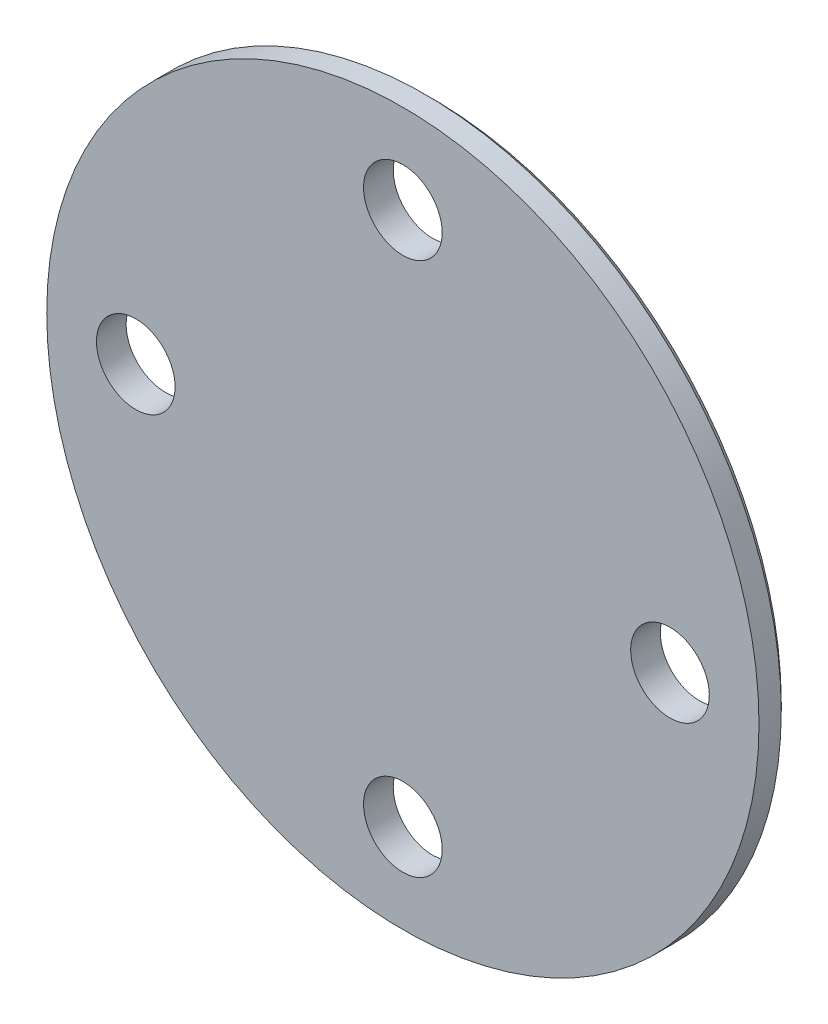
from build123d import *

# Parameters (mm, degrees)
SKETCH1_R            = 24
EXTRUDE1_DEPTH       = 2
M5_CLEARANCE_HOLE1_D = 5.3
CIRPATTERN1_COUNT    = 4
CHAMFER1_SIZE        = 0.5
EXTRUDE3_DEPTH       = 0.6


with BuildPart() as part:
    # Sketch1 → Extrude1 (new body)
    with BuildSketch(Plane.XY):
        Circle(SKETCH1_R)
    extrude(amount=EXTRUDE1_DEPTH)

    # M5 Clearance Hole1 (through all)
    with Locations(Plane.XY.offset(2)):
        with Locations((0, 18)):
            m5_clearance_hole1 = Hole(M5_CLEARANCE_HOLE1_D / 2)

    # CirPattern1: M5 Clearance Hole1 ×4 about axis
    cirpattern1_axis = Axis((0, 0, 0), (0, 0, 1))
    for i in range(1, CIRPATTERN1_COUNT):
        add(m5_clearance_hole1.rotate(cirpattern1_axis, i * 360 / CIRPATTERN1_COUNT), mode=Mode.SUBTRACT)

    # Chamfer1
    chamfer1_edges = [part.edges().sort_by_distance(p)[0] for p in [
        (-24, 0, 0),
    ]]
    chamfer(chamfer1_edges, length=CHAMFER1_SIZE)

    # Sketch5 → Extrude3 (add)
    # profile 1 of 8: a face of its own
    with BuildSketch(Plane(origin=(0, 0, 0), x_dir=(-1, 0, 0), z_dir=(0, 0, -1))):
        with BuildLine():
            add(Edge.make_bspline(
                [(12.477495957, 2.884516023), (12.536071241, 2.891620093), (12.649830325, 2.905416909), (12.815945841, 2.918469115), (12.972334316, 2.926140843), (13.119140248, 2.928060901), (13.256568937, 2.922845549), (13.384387248, 2.911965877), (13.50264742, 2.895216624), (13.611865093, 2.871971693), (13.713460629, 2.843682261), (13.808972596, 2.810349152), (13.89851728, 2.771287362), (13.983929117, 2.72977982), (14.062243389, 2.680769956), (14.136424629, 2.628997822), (14.204920737, 2.571867494), (14.267022146, 2.509156183), (14.323992727, 2.443604504), (14.375074252, 2.3747651), (14.419318927, 2.302802961), (14.45821084, 2.228254683), (14.491140967, 2.150969492), (14.51687187, 2.070387153), (14.537303208, 1.987094789), (14.545712521, 1.930114835), (14.549959398, 1.901338773)],
                knots=[0, 0, 0, 0, 1.646160064, 3.19700812, 4.647898815, 6.01440281, 7.292035329, 8.483544157, 9.592253132, 10.622287969, 11.596797606, 12.533148565, 13.442037284, 14.321633635, 15.179742425, 16.016494889, 16.844435573, 17.664254319, 18.476427132, 19.265941802, 20.053070085, 20.830916409, 21.61023083, 22.393720316, 23.188795335, 24, 24, 24, 24], degree=3))
            add(Edge.make_bspline(
                [(14.549959398, 1.901338773), (14.553241451, 1.871938902), (14.559736814, 1.813754934), (14.559588067, 1.726640245), (14.555188321, 1.640971456), (14.541849257, 1.556756053), (14.523606348, 1.473565488), (14.498453399, 1.391488907), (14.465114438, 1.311310245), (14.426875191, 1.231910054), (14.38192801, 1.154472679), (14.328329249, 1.081180977), (14.269925873, 1.009306125), (14.203429001, 0.941052023), (14.130068239, 0.875773566), (14.049226062, 0.81426467), (13.962452107, 0.754819633), (13.868572007, 0.698100592), (13.766449132, 0.645011869), (13.654810709, 0.597279176), (13.534219292, 0.552666707), (13.404249292, 0.511897383), (13.264550774, 0.475639241), (13.11537684, 0.444264071), (12.957099441, 0.415571869), (12.848080158, 0.401022319), (12.792112677, 0.393552982)],
                knots=[0, 0, 0, 0, 0.8189708, 1.620788478, 2.4103297, 3.193420704, 3.979833012, 4.76883873, 5.568016431, 6.383280226, 7.209529894, 8.044402319, 8.89639626, 9.773593236, 10.681310487, 11.614738811, 12.586038082, 13.594415037, 14.651849842, 15.772145776, 16.956011423, 18.213101613, 19.544486485, 20.953085108, 22.43579826, 24, 24, 24, 24], degree=3))
            add(Edge.make_bspline(
                [(12.792112677, 0.393552982), (12.736250908, 0.387007225), (12.62715872, 0.374224045), (12.467289953, 0.361613871), (12.315543463, 0.355271988), (12.171974094, 0.356438485), (12.036479889, 0.361611814), (11.908872935, 0.374239694), (11.789658367, 0.393271949), (11.678243775, 0.418777778), (11.573687208, 0.449300014), (11.475308633, 0.484749339), (11.382476073, 0.524911506), (11.295672861, 0.57042193), (11.213938231, 0.619640417), (11.138646165, 0.674465823), (11.068383116, 0.73287895), (11.004813284, 0.7968969), (10.946904948, 0.864454975), (10.894922541, 0.934801304), (10.849174306, 1.008194047), (10.80996305, 1.084381352), (10.777119365, 1.163612068), (10.750639958, 1.245286242), (10.72906714, 1.329697292), (10.720845851, 1.38751191), (10.716681153, 1.416799343)],
                knots=[0, 0, 0, 0, 1.559160194, 3.044876667, 4.444802804, 5.768243258, 7.024293308, 8.202639738, 9.320937855, 10.36891014, 11.369226295, 12.338798708, 13.266208898, 14.170984024, 15.054168385, 15.908697757, 16.750671861, 17.584650095, 18.406502976, 19.215671292, 20.007214954, 20.801516048, 21.588502268, 22.382151931, 23.180438801, 24, 24, 24, 24], degree=3))
            add(Edge.make_bspline(
                [(10.716681153, 1.416799343), (10.713798401, 1.445711529), (10.708092042, 1.502942722), (10.706761965, 1.58851482), (10.711455105, 1.672742863), (10.725056397, 1.755331594), (10.741871402, 1.837093235), (10.767858423, 1.917035149), (10.799799269, 1.995543195), (10.837515397, 2.072924332), (10.882081233, 2.147942289), (10.933542689, 2.220077779), (10.991611796, 2.289530168), (11.056909914, 2.354958334), (11.128177613, 2.418039086), (11.205849537, 2.478033831), (11.290928447, 2.534318644), (11.382866855, 2.588213788), (11.48335077, 2.639175317), (11.594628519, 2.684591311), (11.71561774, 2.727702367), (11.84729415, 2.767169113), (11.989951558, 2.801315272), (12.142806188, 2.833365283), (12.30639764, 2.861631058), (12.419315122, 2.876734145), (12.477495957, 2.884516023)],
                knots=[0, 0, 0, 0, 0.811227593, 1.605811631, 2.38795517, 3.163726762, 3.941525875, 4.71714365, 5.507391262, 6.30760138, 7.119181885, 7.941540513, 8.78007692, 9.644729273, 10.520787262, 11.43692308, 12.383447017, 13.368055022, 14.412318111, 15.52722477, 16.722454676, 17.998879864, 19.36445219, 20.818252151, 22.360601563, 24, 24, 24, 24], degree=3))
        make_face()
        with BuildLine():
            add(Edge.make_bspline(
                [(12.513854964, 2.538734439), (12.463855133, 2.532070694), (12.367139077, 2.519180826), (12.227319138, 2.496199253), (12.09754414, 2.470657325), (11.977058314, 2.445035169), (11.867266986, 2.413888899), (11.766745793, 2.382507433), (11.676057106, 2.348381764), (11.594235639, 2.312205785), (11.520861297, 2.271712579), (11.452335117, 2.230868), (11.389955575, 2.185951626), (11.332399495, 2.138951901), (11.279439122, 2.089667366), (11.232927956, 2.036304097), (11.189925025, 1.981757604), (11.142845632, 1.905281925), (11.094359054, 1.808328626), (11.056400076, 1.688257092), (11.039725407, 1.566781211), (11.045486195, 1.486559687), (11.048364346, 1.446480166)],
                knots=[0, 0, 0, 0, 1.481549245, 2.865801675, 4.1609391, 5.366569088, 6.482275719, 7.511592454, 8.458824832, 9.32703844, 10.136451955, 10.918910015, 11.668854611, 12.391634065, 13.100850064, 13.790445644, 14.469047107, 15.138250289, 16.424883389, 17.642709367, 18.822272667, 20, 20, 20, 20], degree=3))
            add(Edge.make_bspline(
                [(11.048364346, 1.446480166), (11.055352189, 1.406532039), (11.06924168, 1.327128547), (11.115727462, 1.213751989), (11.181217413, 1.107805123), (11.250196921, 1.026004325), (11.314097883, 0.965371681), (11.368306397, 0.923949679), (11.426009553, 0.884801628), (11.489487941, 0.851055459), (11.557161895, 0.820586048), (11.629207161, 0.793735228), (11.706246552, 0.77161198), (11.759402862, 0.759597175), (11.786674809, 0.753432957)],
                knots=[0, 0, 0, 0, 1.343251979, 2.669934932, 4.037491568, 5.465357782, 6.208982507, 6.958028626, 7.727853465, 8.521530074, 9.341164449, 10.19081478, 11.071794052, 12, 12, 12, 12], degree=3))
            add(Edge.make_bspline(
                [(11.786674809, 0.753432957), (11.821244316, 0.746665168), (11.891589835, 0.732893388), (12.000073832, 0.718260277), (12.112996247, 0.708597848), (12.230362794, 0.704531881), (12.351905273, 0.704243879), (12.477853154, 0.709971733), (12.608337704, 0.719149127), (12.696674292, 0.729574065), (12.741655278, 0.734882443)],
                knots=[0, 0, 0, 0, 0.880914058, 1.792572832, 2.736348082, 3.714513723, 4.729093608, 5.775502275, 6.867285877, 8, 8, 8, 8], degree=3))
            add(Edge.make_bspline(
                [(12.741655278, 0.734882443), (12.786449829, 0.741125914), (12.873973782, 0.753325015), (13.001850971, 0.774355493), (13.122657028, 0.800111077), (13.237079372, 0.826788402), (13.344363208, 0.85838733), (13.444856533, 0.892308398), (13.539254641, 0.928517217), (13.626435128, 0.968729848), (13.707927946, 1.010899061), (13.78247734, 1.056206711), (13.851241724, 1.102767603), (13.913117529, 1.152034536), (13.968980057, 1.203297605), (14.018970278, 1.256595356), (14.062268866, 1.312626187), (14.110759345, 1.388723528), (14.158963081, 1.485800162), (14.195644461, 1.605560939), (14.214036195, 1.725821945), (14.207454717, 1.805348908), (14.204177814, 1.84494521)],
                knots=[0, 0, 0, 0, 1.328855588, 2.596447408, 3.806487924, 4.957476961, 6.047549486, 7.090885507, 8.073349382, 9.016400378, 9.910289389, 10.767751521, 11.578063205, 12.348689573, 13.089297393, 13.804031864, 14.493032821, 15.166333401, 16.453357801, 17.662459598, 18.836143723, 20, 20, 20, 20], degree=3))
            add(Edge.make_bspline(
                [(14.204177814, 1.84494521), (14.197231442, 1.884911641), (14.183369139, 1.964669353), (14.136034884, 2.078043906), (14.070472276, 2.185080374), (13.99997182, 2.266904792), (13.934278077, 2.327160883), (13.881024653, 2.370950388), (13.822023077, 2.408934853), (13.759322563, 2.444414282), (13.69184736, 2.475087268), (13.620103617, 2.502948706), (13.543867229, 2.526227803), (13.462786282, 2.546846555), (13.37476, 2.562338569), (13.27838954, 2.573414142), (13.172840059, 2.578891885), (13.058487666, 2.580222795), (12.935211448, 2.57733631), (12.802861723, 2.568672943), (12.661321335, 2.55622029), (12.564037474, 2.544684839), (12.513854964, 2.538734439)],
                knots=[0, 0, 0, 0, 1.188402085, 2.371596053, 3.581500958, 4.864415805, 5.527629525, 6.199344559, 6.886481004, 7.585800319, 8.313961935, 9.061439639, 9.845047304, 10.653847106, 11.517469494, 12.468223364, 13.501530155, 14.620478798, 15.826866625, 17.122554849, 18.515710453, 20, 20, 20, 20], degree=3))
        make_face(mode=Mode.SUBTRACT)
    # profile 2 of 8: a face of its own
    with BuildSketch(Plane(origin=(0, 0, 0), x_dir=(-1, 0, 0), z_dir=(0, 0, -1))):
        with BuildLine():
            Line((12.435971824, 5.884157529), (12.293503876, 6.232165174))
            add(Edge.make_bspline(
                [(12.293503876, 6.232165174), (12.331280671, 6.237902871), (12.40534285, 6.249151742), (12.515263329, 6.256469201), (12.621116087, 6.255573137), (12.723268789, 6.248188383), (12.821273107, 6.23022784), (12.916080704, 6.207448974), (13.006173395, 6.17405292), (13.092228333, 6.134008513), (13.173999076, 6.087580944), (13.249553014, 6.033812022), (13.319845204, 5.975072136), (13.384186649, 5.910174885), (13.441771972, 5.838706138), (13.494298416, 5.761768841), (13.540290213, 5.678682518), (13.565798197, 5.619973906), (13.578683496, 5.590317385)],
                knots=[0, 0, 0, 0, 1.172435098, 2.298583014, 3.376645, 4.420068463, 5.437284351, 6.431577994, 7.40903483, 8.380428988, 9.34279227, 10.290642714, 11.222827663, 12.151543775, 13.090597273, 14.036042813, 15.007911516, 16, 16, 16, 16], degree=3))
            add(Edge.make_bspline(
                [(13.578683496, 5.590317385), (13.595146256, 5.545898301), (13.627709113, 5.458038655), (13.656515698, 5.320973388), (13.667456635, 5.182377318), (13.662293481, 5.043912607), (13.641456008, 4.908623912), (13.603087654, 4.780507218), (13.549706476, 4.660497306), (13.479620575, 4.551401837), (13.398553748, 4.453394), (13.307273874, 4.369837509), (13.207798414, 4.299446115), (13.134582671, 4.266176063), (13.097854169, 4.249486221)],
                knots=[0, 0, 0, 0, 1.078578962, 2.133397599, 3.17974609, 4.24031875, 5.284843273, 6.290806044, 7.279915296, 8.268317422, 9.236972897, 10.170611521, 11.082291665, 12, 12, 12, 12], degree=3))
            add(Edge.make_bspline(
                [(13.097854169, 4.249486221), (13.061572721, 4.236020236), (12.990080433, 4.209485625), (12.878581355, 4.189144238), (12.767663499, 4.184468358), (12.657055763, 4.196056075), (12.546201078, 4.222761179), (12.436190489, 4.267630181), (12.32607983, 4.327293502), (12.256620191, 4.377290799), (12.22078586, 4.403084479)],
                knots=[0, 0, 0, 0, 0.991021073, 1.952798622, 2.89245852, 3.829845753, 4.796111031, 5.80685455, 6.868552999, 8, 8, 8, 8], degree=3))
            add(Edge.make_bspline(
                [(12.22078586, 4.403084479), (12.219526842, 4.356226476), (12.217045109, 4.263861612), (12.192368439, 4.128777728), (12.152960151, 3.999731155), (12.113555882, 3.919820709), (12.093900343, 3.87995998)],
                knots=[0, 0, 0, 0, 1.033136608, 2.036482921, 3.020563313, 4, 4, 4, 4], degree=3))
            add(Edge.make_bspline(
                [(12.093900343, 3.87995998), (12.078543603, 3.852949145), (12.048184514, 3.799550812), (11.994922641, 3.725524214), (11.938033664, 3.656675869), (11.875147834, 3.594834717), (11.807500184, 3.539105682), (11.73519472, 3.489377457), (11.658658791, 3.444765587), (11.604188994, 3.42133724), (11.576712009, 3.409518941)],
                knots=[0, 0, 0, 0, 1.044431912, 2.064761268, 3.062869618, 4.045321493, 5.026398593, 6.00719345, 6.994739879, 8, 8, 8, 8], degree=3))
            add(Edge.make_bspline(
                [(11.576712009, 3.409518941), (11.528146448, 3.391802168), (11.431023132, 3.35637147), (11.277609313, 3.328211629), (11.120013893, 3.320003104), (10.98699961, 3.330481543), (10.880986956, 3.349406421), (10.802639283, 3.367501262), (10.727203126, 3.392266067), (10.654000478, 3.421570531), (10.582373472, 3.454573341), (10.513750916, 3.494115708), (10.447121963, 3.538290032), (10.361404648, 3.603254243), (10.261796112, 3.695722452), (10.158484216, 3.823532381), (10.067936362, 3.965041649), (10.021865975, 4.068498043), (9.998434264, 4.121116664)],
                knots=[0, 0, 0, 0, 1.284270031, 2.568333665, 3.862311068, 5.201681707, 5.876450447, 6.540614514, 7.200288132, 7.849314621, 8.501716024, 9.160384414, 9.817441239, 10.489398431, 11.834734864, 13.185968722, 14.56876468, 16, 16, 16, 16], degree=3))
            add(Edge.make_bspline(
                [(9.998434264, 4.121116664), (9.98448603, 4.157270881), (9.957031064, 4.228434934), (9.926676026, 4.336934238), (9.906447723, 4.444219818), (9.89621011, 4.550004096), (9.894194243, 4.654307221), (9.90317057, 4.757524618), (9.922990128, 4.859175558), (9.95073027, 4.959847774), (9.989766503, 5.057830508), (10.037929073, 5.153275096), (10.096981035, 5.244934877), (10.166617348, 5.332609705), (10.24561618, 5.417350973), (10.334175111, 5.499221468), (10.433008428, 5.577256509), (10.504387776, 5.624700604), (10.540851298, 5.648937009)],
                knots=[0, 0, 0, 0, 1.04330458, 2.05358561, 3.029635579, 3.980230507, 4.91300992, 5.835839402, 6.764828419, 7.699152938, 8.644316385, 9.600706471, 10.574594139, 11.57551847, 12.612572148, 13.692170556, 14.821065307, 16, 16, 16, 16], degree=3))
            Line((10.540851298, 5.648937009), (10.677383082, 5.315027755))
            add(Edge.make_bspline(
                [(10.677383082, 5.315027755), (10.65373795, 5.2964148), (10.60791502, 5.260343947), (10.543494503, 5.204681703), (10.486719001, 5.148231168), (10.435505448, 5.092556909), (10.391737469, 5.036105885), (10.354448268, 4.979602235), (10.323405926, 4.923168274), (10.307974482, 4.88433319), (10.300436635, 4.865363291)],
                knots=[0, 0, 0, 0, 1.214774763, 2.354164756, 3.434443773, 4.445303695, 5.405998326, 6.314363494, 7.176611707, 8, 8, 8, 8], degree=3))
            add(Edge.make_bspline(
                [(10.300436635, 4.865363291), (10.292846913, 4.841242462), (10.277756643, 4.793284203), (10.262546746, 4.719287285), (10.256472194, 4.644135648), (10.255900707, 4.567594429), (10.264708044, 4.489923096), (10.279518098, 4.410730966), (10.301642467, 4.33044664), (10.321990395, 4.277771584), (10.332343519, 4.250970263)],
                knots=[0, 0, 0, 0, 0.963882292, 1.916439689, 2.87277145, 3.834760107, 4.830461923, 5.847814843, 6.904957855, 8, 8, 8, 8], degree=3))
            add(Edge.make_bspline(
                [(10.332343519, 4.250970263), (10.345115368, 4.221005513), (10.37014265, 4.16228761), (10.416798439, 4.08083714), (10.467109039, 4.005974141), (10.522949744, 3.938713856), (10.584335386, 3.879369864), (10.64958232, 3.825708989), (10.721347258, 3.781499424), (10.797005636, 3.744515455), (10.8747113, 3.714936469), (10.953168641, 3.694249672), (11.030859219, 3.680743269), (11.108161455, 3.674251709), (11.185012228, 3.677740719), (11.261332792, 3.688055572), (11.337338473, 3.706383801), (11.386437075, 3.725079157), (11.411241422, 3.734523949)],
                knots=[0, 0, 0, 0, 1.169383745, 2.291484635, 3.366132928, 4.407225722, 5.425269315, 6.430078578, 7.436105293, 8.445579998, 9.452391384, 10.418086033, 11.356027765, 12.282959416, 13.198964182, 14.113890661, 15.047147825, 16, 16, 16, 16], degree=3))
            add(Edge.make_bspline(
                [(11.411241422, 3.734523949), (11.443744014, 3.749038521), (11.508278194, 3.777857332), (11.594597459, 3.840091415), (11.673903325, 3.9120459), (11.741040583, 3.997796619), (11.79881302, 4.090987607), (11.840078581, 4.192297391), (11.868064479, 4.297976473), (11.878838889, 4.390439368), (11.878633668, 4.468710098), (11.873887565, 4.533615352), (11.865114718, 4.604029229), (11.850506023, 4.679923591), (11.83186496, 4.761569079), (11.809016255, 4.849050153), (11.780582467, 4.941716883), (11.75916471, 5.004917241), (11.74811876, 5.037512063)],
                knots=[0, 0, 0, 0, 1.128189001, 2.240029169, 3.363390732, 4.520735173, 5.687883177, 6.836443092, 7.982014941, 9.152729103, 9.781413746, 10.466732276, 11.219227681, 12.034588583, 12.921074337, 13.879850625, 14.906558528, 16, 16, 16, 16], degree=3))
            Line((11.74811876, 5.037512063), (12.060509418, 5.1651396))
            add(Edge.make_bspline(
                [(12.060509418, 5.1651396), (12.077015845, 5.127140038), (12.109305848, 5.052804992), (12.170773682, 4.949717131), (12.238401898, 4.855032377), (12.314525542, 4.771777986), (12.394575068, 4.701099063), (12.475533279, 4.643723036), (12.55731121, 4.601699877), (12.639793723, 4.576197507), (12.721540175, 4.565225043), (12.80150871, 4.565821843), (12.880278235, 4.578236403), (12.930134102, 4.595944751), (12.955386221, 4.604914073)],
                knots=[0, 0, 0, 0, 1.268556637, 2.481560593, 3.670351794, 4.829405352, 5.930463306, 6.937762035, 7.863270479, 8.73605307, 9.570118579, 10.38127119, 11.180109913, 12, 12, 12, 12], degree=3))
            add(Edge.make_bspline(
                [(12.955386221, 4.604914073), (12.973363879, 4.612981771), (13.008959735, 4.628955854), (13.058980843, 4.658717162), (13.104348673, 4.693820261), (13.145652427, 4.73362466), (13.182764799, 4.778142839), (13.215385659, 4.827638476), (13.244698618, 4.881291146), (13.268784286, 4.939568175), (13.287903387, 5.000647163), (13.301620776, 5.063187092), (13.308006878, 5.126634592), (13.309027504, 5.190997031), (13.30277369, 5.256063048), (13.29085097, 5.322147984), (13.27224378, 5.388895425), (13.255514215, 5.432883492), (13.247000303, 5.455269642)],
                knots=[0, 0, 0, 0, 0.944852007, 1.87081184, 2.784602064, 3.690965493, 4.617761338, 5.559029823, 6.530699281, 7.546646506, 8.5787509, 9.598157268, 10.612439914, 11.633019719, 12.681569522, 13.742933038, 14.851346722, 16, 16, 16, 16], degree=3))
            add(Edge.make_bspline(
                [(13.247000303, 5.455269642), (13.231043664, 5.490255157), (13.199822918, 5.558707785), (13.135070188, 5.649284809), (13.057892421, 5.725895757), (12.983352612, 5.77767893), (12.916965999, 5.810926523), (12.86268875, 5.833687652), (12.80307935, 5.850952595), (12.738902359, 5.865245462), (12.669903249, 5.875101512), (12.596181463, 5.882969442), (12.517605773, 5.885602269), (12.463671914, 5.884647759), (12.435971824, 5.884157529)],
                knots=[0, 0, 0, 0, 1.399765487, 2.738779866, 4.033557875, 5.349651047, 6.027356497, 6.739255149, 7.492631947, 8.287062432, 9.13537895, 10.032908044, 10.989713993, 12, 12, 12, 12], degree=3))
        make_face()
    # profile 3 of 8: a face of its own
    with BuildSketch(Plane(origin=(0, 0, 0), x_dir=(-1, 0, 0), z_dir=(0, 0, -1))):
        with BuildLine():
            Line((12.012938732, 8.455749342), (12.035199349, 8.092901285))
            Line((12.035199349, 8.092901285), (10.224669167, 7.991986488))
            add(Edge.make_bspline(
                [(10.224669167, 7.991986488), (10.252749137, 7.971935096), (10.307528427, 7.932818206), (10.381481514, 7.867500238), (10.448427309, 7.801552474), (10.486078897, 7.753465899), (10.504410921, 7.730053228)],
                knots=[0, 0, 0, 0, 1.075160859, 2.097457753, 3.073679168, 4, 4, 4, 4], degree=3))
            add(Edge.make_bspline(
                [(10.504410921, 7.730053228), (10.52497768, 7.700469315), (10.565519698, 7.642152321), (10.616431258, 7.549737914), (10.655752967, 7.454282747), (10.68497864, 7.356588327), (10.703573482, 7.256358927), (10.712001506, 7.15338656), (10.708280452, 7.047802314), (10.696230284, 6.940895021), (10.672950949, 6.835460713), (10.641498852, 6.733300987), (10.599246348, 6.636442181), (10.549076429, 6.543616876), (10.487563007, 6.456892298), (10.417528517, 6.374691869), (10.337708894, 6.297957607), (10.278997874, 6.251710427), (10.249155846, 6.228203602)],
                knots=[0, 0, 0, 0, 1.018448499, 2.00760647, 2.976602704, 3.932612498, 4.886034564, 5.854323722, 6.847922934, 7.869057877, 8.892489875, 9.896814069, 10.886861882, 11.876019854, 12.875338693, 13.887378307, 14.926182571, 16, 16, 16, 16], degree=3))
            add(Edge.make_bspline(
                [(10.249155846, 6.228203602), (10.206329561, 6.198598288), (10.122234223, 6.140464159), (9.985456027, 6.074190337), (9.844081995, 6.026779277), (9.698527893, 5.999414558), (9.551190657, 5.991595972), (9.404153423, 6.005498129), (9.258268413, 6.039027318), (9.115992246, 6.093600225), (8.979923677, 6.16464502), (8.855383768, 6.253432352), (8.741131666, 6.355840384), (8.67768869, 6.436198767), (8.645649403, 6.476780492)],
                knots=[0, 0, 0, 0, 1.034471835, 2.031328584, 3.011592854, 3.993029578, 4.968515484, 5.936977143, 6.92167702, 7.936979045, 8.96043929, 9.966578995, 10.973103631, 12, 12, 12, 12], degree=3))
            add(Edge.make_bspline(
                [(8.645649403, 6.476780492), (8.61728218, 6.517886707), (8.561104698, 6.59929206), (8.497690977, 6.732844276), (8.450620514, 6.872198785), (8.4237728, 7.017060353), (8.414921035, 7.16429176), (8.428045134, 7.3103332), (8.460171735, 7.454249577), (8.512991815, 7.593534524), (8.583276231, 7.725623413), (8.668434551, 7.847904028), (8.768780457, 7.95812348), (8.846349181, 8.020172724), (8.885322045, 8.051348133)],
                knots=[0, 0, 0, 0, 1.012341825, 2.004807351, 2.989112693, 3.990490204, 4.986061848, 5.973754194, 6.956650182, 7.970248532, 8.987619532, 9.986224535, 10.988218515, 12, 12, 12, 12], degree=3))
            add(Edge.make_bspline(
                [(8.885322045, 8.051348133), (8.916833145, 8.073245486), (8.980899894, 8.117766059), (9.086249862, 8.173906403), (9.200751394, 8.22190114), (9.302581492, 8.256730947), (9.390350131, 8.279823328), (9.462082621, 8.29632945), (9.539093544, 8.310934942), (9.621198143, 8.324343002), (9.708551156, 8.335592041), (9.801187365, 8.343844962), (9.899063452, 8.352632103), (9.96618275, 8.356050713), (10.000578956, 8.357802627)],
                knots=[0, 0, 0, 0, 1.176130602, 2.391248325, 3.65231281, 4.981322089, 5.687924622, 6.435063414, 7.238468207, 8.09151889, 8.986350708, 9.938965882, 10.943794752, 12, 12, 12, 12], degree=3))
            Line((10.000578956, 8.357802627), (12.012938732, 8.455749342))
        make_face()
        with BuildLine():
            add(Edge.make_bspline(
                [(10.192020263, 7.606877814), (10.175922471, 7.627819246), (10.144244544, 7.669028694), (10.089073545, 7.723066709), (10.03134627, 7.771696657), (9.969261131, 7.813663434), (9.902990698, 7.848510029), (9.832881502, 7.876816538), (9.758824596, 7.898493847), (9.681731797, 7.912866723), (9.603824694, 7.921125366), (9.526721527, 7.92230967), (9.451522248, 7.914275095), (9.377698237, 7.900804034), (9.306005366, 7.877919677), (9.236126643, 7.8482617), (9.167993934, 7.810953783), (9.125218658, 7.780930815), (9.103476092, 7.765670215)],
                knots=[0, 0, 0, 0, 1.034712977, 2.036152643, 3.02105959, 3.992305319, 4.968624123, 5.952144786, 6.952832479, 7.989680339, 9.023438007, 10.022620056, 11.007144776, 11.985004427, 12.960648345, 13.951603421, 14.95880513, 16, 16, 16, 16], degree=3))
            add(Edge.make_bspline(
                [(9.103476092, 7.765670215), (9.082533853, 7.749572822), (9.041322817, 7.717895681), (8.987296355, 7.662718968), (8.9386237, 7.605012818), (8.896936283, 7.54303152), (8.861575819, 7.477262431), (8.833796666, 7.407117323), (8.810837203, 7.333366945), (8.796922464, 7.256104838), (8.788083297, 7.178211823), (8.788680737, 7.10117957), (8.794666575, 7.025741766), (8.810163244, 6.952361793), (8.83114405, 6.880378231), (8.861822013, 6.811358128), (8.897537679, 6.743018982), (8.927827231, 6.700786001), (8.94319965, 6.679352106)],
                knots=[0, 0, 0, 0, 1.036611908, 2.03988944, 3.026603913, 3.999632096, 4.969159816, 5.954485461, 6.959784832, 7.99853554, 9.034190386, 10.035158984, 11.020580473, 12.002112788, 12.976692696, 13.960531562, 14.964938065, 16, 16, 16, 16], degree=3))
            add(Edge.make_bspline(
                [(8.94319965, 6.679352106), (8.959297076, 6.65840998), (8.990974283, 6.617199164), (9.046150519, 6.563171095), (9.103858434, 6.514504383), (9.165833252, 6.472795154), (9.231626507, 6.437516029), (9.301613759, 6.409452948), (9.375648779, 6.387701567), (9.452745918, 6.373463485), (9.530657185, 6.364745945), (9.607711109, 6.365199028), (9.682999398, 6.371630288), (9.756787375, 6.385482479), (9.828111397, 6.408311943), (9.897961345, 6.437234834), (9.965400443, 6.474439898), (10.008002048, 6.504097335), (10.029517759, 6.519075664)],
                knots=[0, 0, 0, 0, 1.037026553, 2.040705396, 3.027814555, 4.001231949, 4.97114748, 5.956867255, 6.959792444, 7.998958653, 9.035027761, 10.036396747, 11.022212404, 12.002258509, 12.980083926, 13.960515725, 14.969969496, 16, 16, 16, 16], degree=3))
            add(Edge.make_bspline(
                [(10.029517759, 6.519075664), (10.050343069, 6.535546508), (10.091481824, 6.568083359), (10.14720046, 6.622236555), (10.19601331, 6.680634307), (10.237417761, 6.743052418), (10.272662792, 6.809150699), (10.302008545, 6.878991998), (10.323095363, 6.953340489), (10.337755383, 7.030323736), (10.346325167, 7.108023464), (10.34590334, 7.185069549), (10.339463936, 7.260359881), (10.325613902, 7.334147316), (10.302783862, 7.405471484), (10.273861126, 7.475321392), (10.23665602, 7.542760501), (10.206998588, 7.585362105), (10.192020263, 7.606877814)],
                knots=[0, 0, 0, 0, 1.041109591, 2.056629784, 3.041798165, 4.021360105, 4.989368663, 5.976827915, 6.987096543, 8.014689681, 9.04872175, 10.048121922, 11.031999344, 12.010118559, 12.986021452, 13.964525601, 14.971994662, 16, 16, 16, 16], degree=3))
        make_face(mode=Mode.SUBTRACT)
    # profile 4 of 8: a face of its own
    with BuildSketch(Plane(origin=(0, 0, 0), x_dir=(-1, 0, 0), z_dir=(0, 0, -1))):
        with BuildLine():
            Line((7.639092882, 11.06218737), (7.364545273, 11.281825458))
            add(Edge.make_bspline(
                [(7.364545273, 11.281825458), (7.393948519, 11.314973147), (7.451817577, 11.38021171), (7.546209318, 11.467924384), (7.645388836, 11.544136401), (7.748848205, 11.608788922), (7.856131491, 11.663029298), (7.968378205, 11.704260707), (8.084432029, 11.736086294), (8.204161292, 11.754671081), (8.324345184, 11.763164954), (8.443209634, 11.759547043), (8.559232028, 11.74372361), (8.67252714, 11.717277405), (8.782594919, 11.678087168), (8.889810443, 11.627160506), (8.994722588, 11.565176336), (9.060273943, 11.515484889), (9.093453192, 11.490333237)],
                knots=[0, 0, 0, 0, 1.095909988, 2.15688017, 3.182669843, 4.186256004, 5.171574786, 6.151480736, 7.140214845, 8.144360678, 9.144207683, 10.117786273, 11.081135212, 12.037127031, 12.991412999, 13.966029786, 14.970492629, 16, 16, 16, 16], degree=3))
            add(Edge.make_bspline(
                [(9.093453192, 11.490333237), (9.125141549, 11.46395084), (9.187229999, 11.412258601), (9.269814503, 11.326306204), (9.341373532, 11.236364789), (9.40212859, 11.14232042), (9.45143496, 11.043799627), (9.489338707, 10.940989034), (9.516324074, 10.834041497), (9.531443978, 10.724042989), (9.53646385, 10.613783465), (9.53242167, 10.505437007), (9.517424094, 10.400579136), (9.49277115, 10.298973319), (9.458643078, 10.200359793), (9.413719675, 10.105380922), (9.359544347, 10.013062406), (9.315933147, 9.955905358), (9.293798745, 9.926895904)],
                knots=[0, 0, 0, 0, 1.123542395, 2.201408105, 3.243032439, 4.253181805, 5.248431698, 6.240592344, 7.235042243, 8.249795829, 9.262463266, 10.241147734, 11.201538298, 12.145305737, 13.087988317, 14.041320846, 15.005893153, 16, 16, 16, 16], degree=3))
            add(Edge.make_bspline(
                [(9.293798745, 9.926895904), (9.260419411, 9.887830931), (9.194177804, 9.81030612), (9.077506498, 9.711654507), (8.950470973, 9.627418002), (8.833864604, 9.571071922), (8.731694715, 9.53171921), (8.64367568, 9.504152245), (8.545602663, 9.475620041), (8.436600924, 9.44862326), (8.316969357, 9.421573514), (8.186343919, 9.397097623), (8.045462283, 9.371464557), (7.947808525, 9.356076404), (7.897316039, 9.348119862)],
                knots=[0, 0, 0, 0, 1.190790912, 2.363135909, 3.53168066, 4.72025599, 5.359851444, 6.071430558, 6.859886536, 7.729989461, 8.676956021, 9.705880253, 10.813811035, 12, 12, 12, 12], degree=3))
            Line((7.897316039, 9.348119862), (6.569841246, 9.14777431))
            Line((6.569841246, 9.14777431), (7.892863916, 8.091879044))
            Line((7.892863916, 8.091879044), (7.671741787, 7.815105373))
            Line((7.671741787, 7.815105373), (5.725421842, 9.368896438))
            Line((5.725421842, 9.368896438), (7.763752337, 9.676834973))
            add(Edge.make_bspline(
                [(7.763752337, 9.676834973), (7.813244418, 9.684353914), (7.9086072, 9.698841629), (8.045317654, 9.722048948), (8.17043147, 9.743774621), (8.283167706, 9.766947381), (8.384404846, 9.78977867), (8.473660485, 9.812762108), (8.55147917, 9.834451274), (8.637758445, 9.864907738), (8.734264789, 9.908158897), (8.837378692, 9.974519382), (8.932443314, 10.050593043), (8.984790211, 10.11198235), (9.011088909, 10.142823889)],
                knots=[0, 0, 0, 0, 1.319955893, 2.543329461, 3.656340969, 4.668076674, 5.577805766, 6.392443046, 7.098376601, 7.706873727, 8.804201593, 9.87714832, 10.933494828, 12, 12, 12, 12], degree=3))
            add(Edge.make_bspline(
                [(9.011088909, 10.142823889), (9.026371954, 10.163052456), (9.056499743, 10.202929455), (9.093533922, 10.267278417), (9.123776618, 10.333776217), (9.145646248, 10.403140553), (9.161882224, 10.474554075), (9.168657135, 10.548545444), (9.169691454, 10.624783265), (9.162679655, 10.702468836), (9.149843606, 10.780102838), (9.128890616, 10.855102534), (9.101356652, 10.926678817), (9.067211464, 10.994814681), (9.025044327, 11.05879388), (8.976820762, 11.119801994), (8.921550888, 11.177359648), (8.880563277, 11.212176131), (8.859716714, 11.229884018)],
                knots=[0, 0, 0, 0, 0.996667875, 1.964752361, 2.914317364, 3.865277614, 4.821600465, 5.789929485, 6.782598485, 7.81785763, 8.854579393, 9.874540115, 10.875758576, 11.86804589, 12.866754612, 13.885042657, 14.924319049, 16, 16, 16, 16], degree=3))
            add(Edge.make_bspline(
                [(8.859716714, 11.229884018), (8.83671801, 11.247057066), (8.791654561, 11.28070578), (8.720577183, 11.324534802), (8.647234321, 11.359050625), (8.572317053, 11.38637589), (8.495881612, 11.404755932), (8.417564676, 11.41545174), (8.337754365, 11.41726651), (8.256504589, 11.412212234), (8.175104894, 11.399033895), (8.094450213, 11.37668807), (8.015672604, 11.344724539), (7.936896623, 11.306348311), (7.860190419, 11.257855339), (7.78469123, 11.200819742), (7.710433253, 11.135413274), (7.663264365, 11.086997707), (7.639092882, 11.06218737)],
                knots=[0, 0, 0, 0, 1.004267948, 1.967753483, 2.916387242, 3.836390603, 4.753865693, 5.662230236, 6.597459989, 7.54292899, 8.507774529, 9.478041027, 10.464999202, 11.479252724, 12.540863768, 13.635008289, 14.788070758, 16, 16, 16, 16], degree=3))
        make_face()
    # profile 5 of 8: a face of its own
    with BuildSketch(Plane(origin=(0, 0, 0), x_dir=(-1, 0, 0), z_dir=(0, 0, -1))):
        Polygon((2.270471875, 14.433158554), (2.630351849, 14.342632045), (2.253405402, 12.840040399), (4.075065892, 12.38295573), (4.452012339, 13.885547377), (4.811892314, 13.795020868), (3.912563388, 10.213287594), (3.552683413, 10.303814103), (3.986765444, 12.032722023), (2.165104954, 12.489806691), (1.731022923, 10.760898772), (1.371142948, 10.851425281), align=None)
    # profile 6 of 8: a face of its own
    with BuildSketch(Plane(origin=(0, 0, 0), x_dir=(-1, 0, 0), z_dir=(0, 0, -1))):
        with BuildLine():
            Line((0.340436256, 13.903457101), (0.077018955, 13.651912129))
            add(Edge.make_bspline(
                [(0.077018955, 13.651912129), (0.054268609, 13.675172236), (0.009223594, 13.721226563), (-0.062284969, 13.78530919), (-0.136782476, 13.843711783), (-0.212815478, 13.898227879), (-0.292187046, 13.946573665), (-0.373799207, 13.9901581), (-0.457601434, 14.030087486), (-0.573599471, 14.074024029), (-0.723015038, 14.117624015), (-0.908586966, 14.149876513), (-1.10043025, 14.160725156), (-1.229470812, 14.151023024), (-1.294977072, 14.146097826)],
                knots=[0, 0, 0, 0, 0.774098238, 1.532691697, 2.282766395, 3.025811271, 3.757652585, 4.492328489, 5.226933662, 5.964738514, 7.441814741, 8.923246753, 10.43811438, 12, 12, 12, 12], degree=3))
            add(Edge.make_bspline(
                [(-1.294977072, 14.146097826), (-1.330902106, 14.141562005), (-1.40235001, 14.132541138), (-1.507790345, 14.111822655), (-1.610439605, 14.083902572), (-1.711020381, 14.051144905), (-1.80786027, 14.009583219), (-1.902737068, 13.963952741), (-1.994257908, 13.910761417), (-2.08275819, 13.851824206), (-2.166976485, 13.7875611), (-2.245862742, 13.718981378), (-2.319461314, 13.647111314), (-2.387410033, 13.57120763), (-2.449105923, 13.490636616), (-2.50525024, 13.406290408), (-2.55627082, 13.318275648), (-2.600441378, 13.226318044), (-2.638996376, 13.131697291), (-2.671105537, 13.034801746), (-2.696364401, 12.935869343), (-2.714922141, 12.834717253), (-2.726796366, 12.731340738), (-2.731845252, 12.625762929), (-2.730654852, 12.518174828), (-2.724329302, 12.446101687), (-2.7211406, 12.409769701)],
                knots=[0, 0, 0, 0, 1.040162322, 2.068680532, 3.083979911, 4.095217528, 5.104855875, 6.109153311, 7.118391445, 8.143269915, 9.162342363, 10.159752587, 11.144680363, 12.116056106, 13.083994629, 14.057629177, 15.025437263, 16.00434788, 16.986143105, 17.959181007, 18.934706838, 19.917350379, 20.911641985, 21.921955333, 22.952460119, 24, 24, 24, 24], degree=3))
            add(Edge.make_bspline(
                [(-2.7211406, 12.409769701), (-2.713985851, 12.355429993), (-2.699912544, 12.248544425), (-2.661834965, 12.093547795), (-2.609375282, 11.947456519), (-2.544890881, 11.809042962), (-2.465679076, 11.679204659), (-2.372521909, 11.558170702), (-2.266294277, 11.445160898), (-2.147579549, 11.342170216), (-2.018996344, 11.250721206), (-1.883627181, 11.171720656), (-1.741062612, 11.1098409), (-1.593201711, 11.060806301), (-1.439185059, 11.027664779), (-1.279194257, 11.009240054), (-1.113195459, 11.005116496), (-1.001092445, 11.014463154), (-0.944001344, 11.01922316)],
                knots=[0, 0, 0, 0, 1.042023097, 2.049647179, 3.028871096, 3.990737617, 4.949353606, 5.915812059, 6.891060461, 7.894898704, 8.900180327, 9.888775021, 10.87049378, 11.850994133, 12.847672957, 13.86138612, 14.910860499, 16, 16, 16, 16], degree=3))
            add(Edge.make_bspline(
                [(-0.944001344, 11.01922316), (-0.88142342, 11.027503678), (-0.758427841, 11.043778861), (-0.580406521, 11.091357196), (-0.412315268, 11.157112255), (-0.253845144, 11.240225069), (-0.105277511, 11.341657159), (0.033154345, 11.461231057), (0.162285544, 11.598656548), (0.23760002, 11.701533675), (0.275880467, 11.75382352)],
                knots=[0, 0, 0, 0, 1.028467028, 2.021430066, 2.995839138, 3.966434528, 4.932965598, 5.922507091, 6.944062817, 8, 8, 8, 8], degree=3))
            Line((0.275880467, 11.75382352), (0.586045063, 11.566092317))
            add(Edge.make_bspline(
                [(0.586045063, 11.566092317), (0.565920408, 11.535139224), (0.525969325, 11.473691731), (0.459055804, 11.386781913), (0.388759635, 11.303348983), (0.313177328, 11.224466317), (0.231655136, 11.151516246), (0.147423879, 11.080935218), (0.056818556, 11.016657127), (-0.037364727, 10.955765083), (-0.136484032, 10.900931411), (-0.239061253, 10.851250291), (-0.345000531, 10.806208451), (-0.455520079, 10.769106531), (-0.568550093, 10.735015974), (-0.6859623, 10.708756917), (-0.806518841, 10.687008583), (-0.888538909, 10.67700334), (-0.929902953, 10.671957535)],
                knots=[0, 0, 0, 0, 0.971284838, 1.92817622, 2.884159431, 3.841714782, 4.80019892, 5.761992826, 6.732077267, 7.721578726, 8.712299825, 9.710859232, 10.720306811, 11.739279662, 12.777387795, 13.825872494, 14.903552381, 16, 16, 16, 16], degree=3))
            add(Edge.make_bspline(
                [(-0.929902953, 10.671957535), (-0.969456031, 10.668475645), (-1.04748537, 10.661606657), (-1.163336495, 10.656045123), (-1.276496774, 10.657098852), (-1.387008631, 10.662523029), (-1.494866481, 10.675010199), (-1.600523242, 10.690794875), (-1.703328125, 10.713050947), (-1.803160017, 10.741033908), (-1.901019149, 10.772300899), (-1.995460298, 10.811411247), (-2.087968216, 10.854443787), (-2.177945569, 10.902521041), (-2.264728945, 10.956884544), (-2.348738659, 11.01660869), (-2.430619982, 11.080819101), (-2.48223988, 11.127728963), (-2.508180698, 11.151302821)],
                knots=[0, 0, 0, 0, 1.118045774, 2.205653244, 3.264331001, 4.30358607, 5.319616739, 6.320422503, 7.310825888, 8.279038094, 9.239326886, 10.201583744, 11.155028633, 12.111673437, 13.072164268, 14.036460635, 15.013252293, 16, 16, 16, 16], degree=3))
            add(Edge.make_bspline(
                [(-2.508180698, 11.151302821), (-2.55008524, 11.192819669), (-2.633125873, 11.275092025), (-2.742117598, 11.411481362), (-2.838608723, 11.555227115), (-2.921302493, 11.707927949), (-2.9896968, 11.86949983), (-3.043521374, 12.039530296), (-3.085365292, 12.21758019), (-3.100686785, 12.340078515), (-3.108475336, 12.402349495)],
                knots=[0, 0, 0, 0, 0.99744677, 1.976602244, 2.948187961, 3.923875643, 4.910338615, 5.912306036, 6.93873856, 8, 8, 8, 8], degree=3))
            add(Edge.make_bspline(
                [(-3.108475336, 12.402349495), (-3.113777701, 12.468100125), (-3.124216805, 12.597547586), (-3.116527573, 12.789689531), (-3.092875823, 12.975836864), (-3.048304823, 13.155440904), (-2.986710498, 13.329449564), (-2.905939679, 13.496843942), (-2.807364379, 13.658422657), (-2.690541767, 13.811158916), (-2.560145948, 13.953990927), (-2.417274247, 14.082098246), (-2.263661787, 14.194028987), (-2.099380333, 14.289647321), (-1.924224123, 14.368483916), (-1.738405409, 14.430457142), (-1.542383011, 14.478317394), (-1.407001896, 14.495657548), (-1.338014265, 14.50449376)],
                knots=[0, 0, 0, 0, 1.03081534, 2.029431954, 3.001049311, 3.960828571, 4.917609783, 5.883039539, 6.862250468, 7.87265741, 8.885652659, 9.882792244, 10.868521775, 11.853096948, 12.85033407, 13.86686092, 14.91299305, 16, 16, 16, 16], degree=3))
            add(Edge.make_bspline(
                [(-1.338014265, 14.50449376), (-1.29575303, 14.508505101), (-1.21234496, 14.516422007), (-1.08794009, 14.518658211), (-0.966100772, 14.516048486), (-0.846587661, 14.506728142), (-0.729787494, 14.489121039), (-0.615224468, 14.466423034), (-0.502976787, 14.436626825), (-0.393496544, 14.400345383), (-0.287151354, 14.358065622), (-0.184938539, 14.309758167), (-0.086506172, 14.256489981), (0.006984067, 14.196592439), (0.097210503, 14.132362739), (0.182343347, 14.06125629), (0.264661799, 13.985987433), (0.315101846, 13.931050268), (0.340436256, 13.903457101)],
                knots=[0, 0, 0, 0, 1.099051256, 2.169121252, 3.219979555, 4.254664697, 5.271104791, 6.277381345, 7.278014723, 8.276677783, 9.262791547, 10.239938839, 11.203107283, 12.159177474, 13.113830278, 14.069342355, 15.03029289, 16, 16, 16, 16], degree=3))
        make_face()
    # profile 7 of 8: a face of its own
    with BuildSketch(Plane(origin=(0, 0, 0), x_dir=(-1, 0, 0), z_dir=(0, 0, -1))):
        Polygon((-6.798286681, 12.969166129), (-4.863097044, 13.83510413), (-4.71395091, 13.501936896), (-6.311521189, 12.78737109), (-5.839596109, 11.731475825), (-4.256124221, 12.439363445), (-4.107720108, 12.109164293), (-5.691191996, 11.401276673), (-5.099059584, 10.076769962), (-3.515587696, 10.784657582), (-3.366441562, 10.451490348), (-5.287532808, 9.592230532), align=None)
    # profile 8 of 8: a face of its own
    with BuildSketch(Plane(origin=(0, 0, 0), x_dir=(-1, 0, 0), z_dir=(0, 0, -1))):
        Polygon((-8.885751157, 6.389149455), (-11.033158676, 9.408431139), (-10.989379462, 9.449984291), (-7.835792056, 8.293916249), (-8.8367778, 11.49276691), (-8.793740607, 11.533578041), (-5.887246049, 9.234798327), (-6.149179309, 8.986221437), (-8.214964565, 10.64166932), (-7.350510605, 7.845735827), (-7.417292456, 7.782664079), (-10.189481292, 8.796264172), (-8.629012041, 6.632532201), align=None)
    extrude(amount=EXTRUDE3_DEPTH)


solid = part.part
